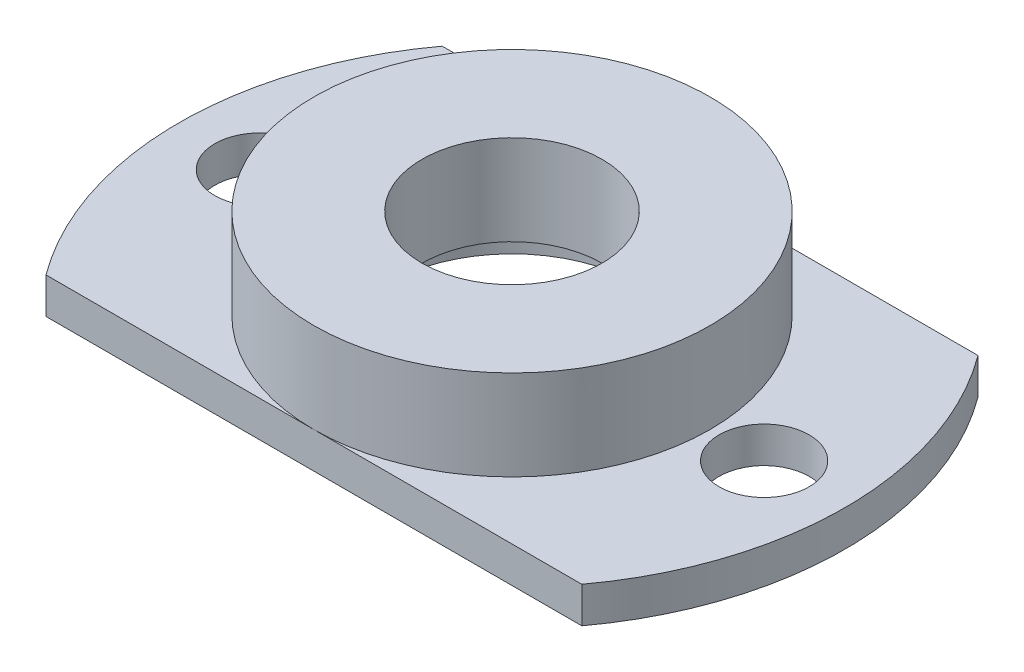
from build123d import *

# Parameters (mm, degrees)
SKETCH_1_R          = 5
EXTRUDE_1_DEPTH     = 2
SKETCH_2_R          = 11
SKETCH_2_R_2        = 5
EXTRUDE_2_DEPTH     = 5
SKETCH_3_R          = 2.5
CUT_EXTRUDE_1_DEPTH = 23.632940596
SKETCH_4_R          = 7
CUT_EXTRUDE_2_DEPTH = 2


with BuildPart() as part:
    # 草图1 → 凸台-拉伸1 (new body)
    with BuildSketch(Plane(origin=(0, 0, 0), x_dir=(1, 0, 0), z_dir=(0, 1, 0))):
        with BuildLine():
            Line((-14.874474781, 11), (14.874474781, 11))
            ThreePointArc((14.874474781, 11), (18.5, 0), (14.874474781, -11))
            Line((14.874474781, -11), (-14.874474781, -11))
            ThreePointArc((-14.874474781, -11), (-18.5, 0), (-14.874474781, 11))
        make_face()
        with Locations(Location((0, 0, 0), (0, 0, 270))):
            Circle(SKETCH_1_R, mode=Mode.SUBTRACT)
    extrude(amount=EXTRUDE_1_DEPTH)

    # 草图2 → 凸台-拉伸2 (add)
    with BuildSketch(Plane(origin=(0, 2, 0), x_dir=(1, 0, 0), z_dir=(0, 1, 0))):
        with Locations(Location((0, 0, 0), (0, 0, 270))):
            Circle(SKETCH_2_R)
        with Locations(Location((0, 0, 0), (0, 0, 270))):
            Circle(SKETCH_2_R_2, mode=Mode.SUBTRACT)
    extrude(amount=EXTRUDE_2_DEPTH)

    # 草图3 → 切除-拉伸1 (cut, through all)
    with BuildSketch(Plane.XZ):
        with Locations(Location((-14, 0, 0), (0, 0, 270))):
            Circle(SKETCH_3_R)
        with Locations(Location((14, 0, 0), (0, 0, 270))):
            Circle(SKETCH_3_R)
    extrude(amount=-CUT_EXTRUDE_1_DEPTH, mode=Mode.SUBTRACT)

    # 草图4 → 切除-拉伸2 (cut)
    with BuildSketch(Plane.XZ):
        with Locations(Location((0, 0, 0), (0, 0, 270))):
            Circle(SKETCH_4_R)
    extrude(amount=-CUT_EXTRUDE_2_DEPTH, mode=Mode.SUBTRACT)


solid = part.part
